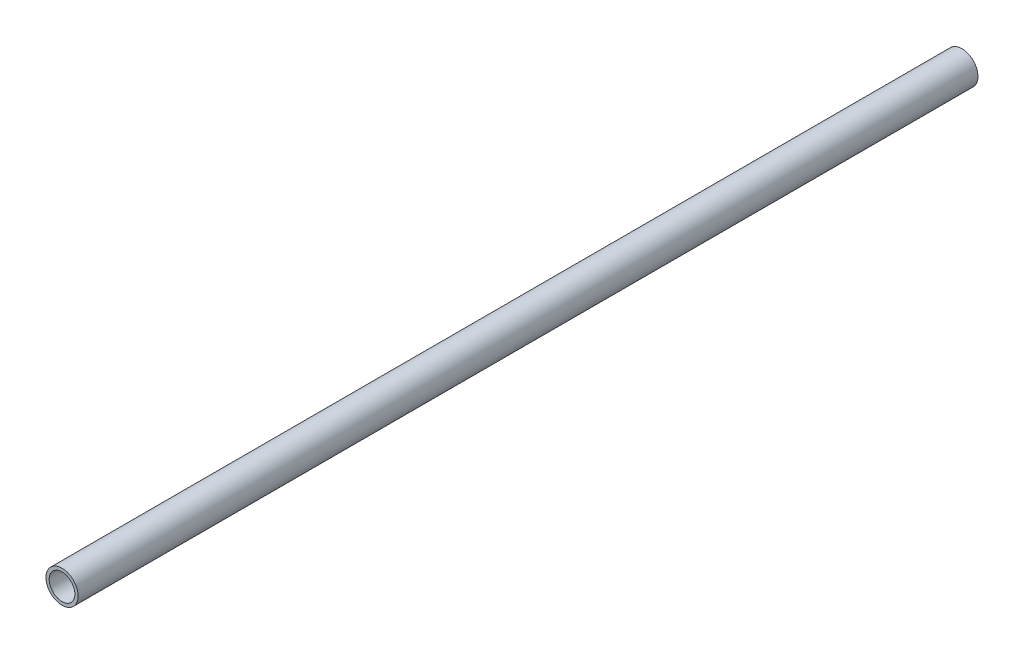
from build123d import *

# Parameters (mm, degrees)
SKETCH1_R          = 5
SKETCH3_R          = 5
SKETCH2_R          = 4
CUT_EXTRUDE1_DEPTH = 326


with BuildPart() as part:
    # Sketch1 → Loft1 section 0
    with BuildSketch(Plane.XY):
        Circle(SKETCH1_R)
    # Sketch3 → Loft1 section 1
    with BuildSketch(Plane.XY.offset(280)):
        Circle(SKETCH3_R)
    loft()

    # Sketch2 → Cut-Extrude1 (cut)
    with BuildSketch(Plane.XY):
        with Locations(Location((0, 0, 0), (0, 0, 180))):
            Circle(SKETCH2_R)
    extrude(amount=CUT_EXTRUDE1_DEPTH, mode=Mode.SUBTRACT)


solid = part.part
